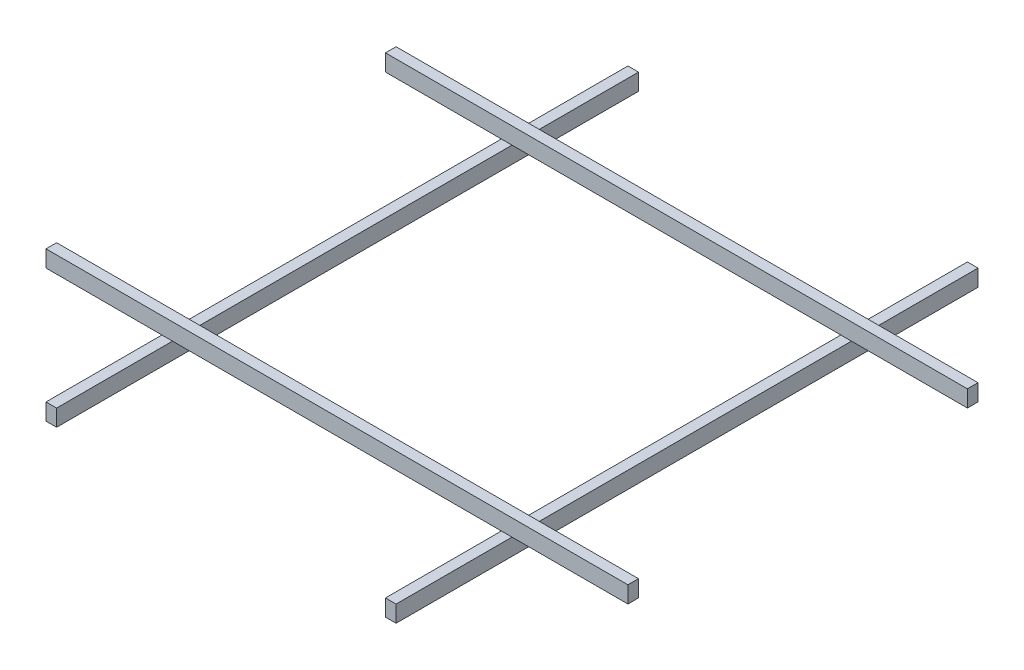
from build123d import *

# Parameters (mm, degrees)
SKETCH1_W              = 88.9
SKETCH1_H              = 139.7
PROFILES_4X6_1_DEPTH   = 4876.8
SKETCH1_ON_SEGMENT_2_W = 88.9
SKETCH1_ON_SEGMENT_2_H = 139.7
PROFILES_4X6_1_2_DEPTH = 4876.8
SKETCH1_ON_SEGMENT_3_W = 88.9
SKETCH1_ON_SEGMENT_3_H = 139.7
PROFILES_4X6_1_3_DEPTH = 4876.8
SKETCH1_ON_SEGMENT_4_W = 88.9
SKETCH1_ON_SEGMENT_4_H = 139.7
PROFILES_4X6_1_4_DEPTH = 4876.8


with BuildPart() as part:
    # Sketch1 → Profiles 4X6(1) (new body)
    with BuildSketch(Plane(origin=(711.2, 0, 0), x_dir=(-1, 0, 0), z_dir=(0, 0, -1))):
        Rectangle(SKETCH1_W, SKETCH1_H)
    extrude(amount=PROFILES_4X6_1_DEPTH)


with BuildPart() as body_2:
    # Sketch1 on segment 2 (carried to segment 2) → Profiles 4X6_1 2 (new body)
    with BuildSketch(Plane(origin=(3556, 0, 0), x_dir=(-1, 0, 0), z_dir=(0, 0, -1))):
        Rectangle(SKETCH1_ON_SEGMENT_2_W, SKETCH1_ON_SEGMENT_2_H)
    extrude(amount=PROFILES_4X6_1_2_DEPTH)


with BuildPart() as body_3:
    # Sketch1 on segment 3 (carried to segment 3) → Profiles 4X6_1 3 (new body)
    with BuildSketch(Plane(origin=(-304.8, 139.7, -3860.8), x_dir=(0, 0, -1), z_dir=(1, 0, 0))):
        Rectangle(SKETCH1_ON_SEGMENT_3_W, SKETCH1_ON_SEGMENT_3_H)
    extrude(amount=PROFILES_4X6_1_3_DEPTH)


with BuildPart() as body_4:
    # Sketch1 on segment 4 (carried to segment 4) → Profiles 4X6_1 4 (new body)
    with BuildSketch(Plane(origin=(4572, 139.7, -1016), x_dir=(0, 0, 1), z_dir=(-1, 0, 0))):
        Rectangle(SKETCH1_ON_SEGMENT_4_W, SKETCH1_ON_SEGMENT_4_H)
    extrude(amount=PROFILES_4X6_1_4_DEPTH)


solid = Compound([part.part, body_2.part, body_3.part, body_4.part])
